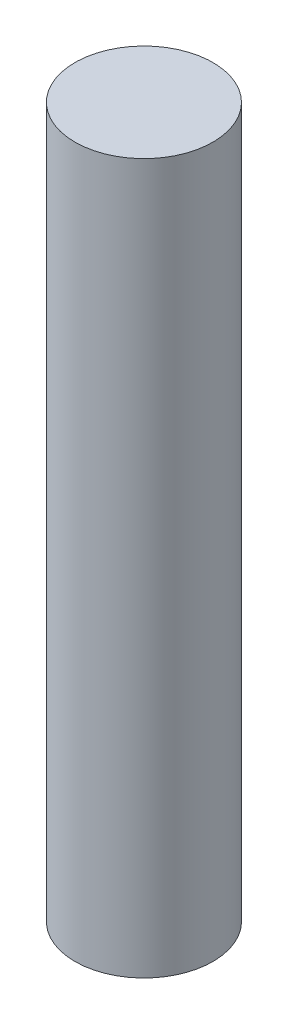
from build123d import *

# Parameters (mm, degrees)
SKETCH1_R           = 2.778125
BOSS_EXTRUDE1_DEPTH = 28.575


with BuildPart() as part:
    # Sketch1 → Boss-Extrude1 (new body)
    with BuildSketch(Plane(origin=(0, 0, 0), x_dir=(1, 0, 0), z_dir=(0, 1, 0))):
        with Locations(Location((0, 0, 0), (0, 0, 270))):
            Circle(SKETCH1_R)
    extrude(amount=BOSS_EXTRUDE1_DEPTH)


solid = part.part
